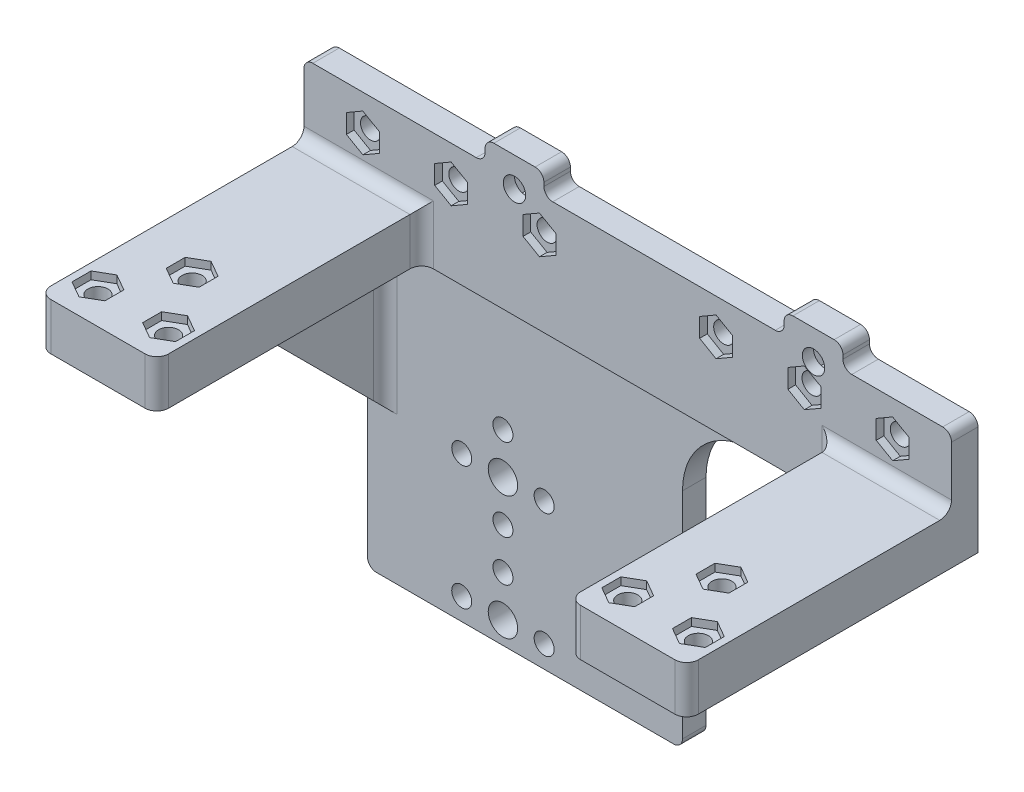
from build123d import *

# Parameters (mm, degrees)
SKETCH_1_W          = 110
SKETCH_1_H          = 20
SKETCH_1_R          = 1.7
EXTRUDE_1_DEPTH     = 4.5
SKETCH_2_W          = 20
SKETCH_2_H          = 8
EXTRUDE_2_DEPTH     = 45
SKETCH_4_W          = 10
SKETCH_4_H          = 10
EXTRUDE_3_DEPTH     = 4.5
SKETCH_5_R          = 1.9
SKETCH_5_R_2        = 1.7
CUT_EXTRUDE_1_DEPTH = 75.885745444
CUT_EXTRUDE_2_DEPTH = 1.3
CUT_EXTRUDE_3_DEPTH = 2.6
SKETCH_7_R          = 1.7
CUT_EXTRUDE_5_DEPTH = 78.673192742
CUT_EXTRUDE_6_DEPTH = 1.3
SKETCH_9_W          = 80
SKETCH_9_H          = 4
EXTRUDE_4_DEPTH     = 50
SKETCH_11_W         = 17.2
SKETCH_11_H         = 50
SKETCH_11_W_2       = 9.3
SKETCH_11_R         = 2.5
SKETCH_11_R_2       = 1.7
CUT_EXTRUDE_7_DEPTH = 90.304255218
RIB_4_REACH         = 124.026
SKETCH_12_WALL_W    = 281.40730074
SKETCH_12_WALL_H    = 3
FILLET_1_R          = 2
FILLET_2_R          = 1.5
FILLET_3_R          = 2
FILLET_4_R          = 12


with BuildPart() as part:
    # 草图1 → 凸台-拉伸1 (new body)
    with BuildSketch(Plane.XY):
        with Locations((0, 10)):
            Rectangle(SKETCH_1_W, SKETCH_1_H)
        with Locations((-45, 14)):
            Circle(SKETCH_1_R, mode=Mode.SUBTRACT)
        with Locations((-30, 14)):
            Circle(SKETCH_1_R, mode=Mode.SUBTRACT)
        with Locations((-15, 14)):
            Circle(SKETCH_1_R, mode=Mode.SUBTRACT)
        with Locations((15, 14)):
            Circle(SKETCH_1_R, mode=Mode.SUBTRACT)
        with Locations((30, 14)):
            Circle(SKETCH_1_R, mode=Mode.SUBTRACT)
        with Locations((45, 14)):
            Circle(SKETCH_1_R, mode=Mode.SUBTRACT)
    extrude(amount=EXTRUDE_1_DEPTH)

    # 草图2 → 凸台-拉伸2 (add)
    with BuildSketch(Plane.XY.offset(4.5)):
        with Locations((-45, 4)):
            Rectangle(SKETCH_2_W, SKETCH_2_H)
        with Locations((45, 4)):
            Rectangle(SKETCH_2_W, SKETCH_2_H)
    extrude(amount=EXTRUDE_2_DEPTH)

    # 草图4 → 凸台-拉伸3 (add)
    with BuildSketch(Plane.XY.offset(4.5)):
        with Locations((-19.238259457, 18.6193749)):
            Rectangle(SKETCH_4_W, SKETCH_4_H)
        with Locations((31.561740543, 18.6193749)):
            Rectangle(SKETCH_4_W, SKETCH_4_H)
    extrude(amount=-EXTRUDE_3_DEPTH)

    # 草图5 → 切除-拉伸1 (cut, through all)
    with BuildSketch(Plane.XY.offset(4.5)):
        with Locations((-19.238259457, 18.6193749)):
            Circle(SKETCH_5_R)
        with Locations((31.561740543, 18.6193749)):
            Circle(SKETCH_5_R)
        with Locations((-15, 14)):
            Circle(SKETCH_5_R_2)
        with Locations((30, 14)):
            Circle(SKETCH_5_R_2)
    extrude(amount=-CUT_EXTRUDE_1_DEPTH, mode=Mode.SUBTRACT)

    # 草图3 → 切除-拉伸2 (cut)
    with BuildSketch(Plane.XY.offset(4.5)):
        Polygon((-45, 17.22), (-47.7886018, 15.61), (-47.7886018, 12.39), (-45, 10.78), (-42.2113982, 12.39), (-42.2113982, 15.61), align=None)
        Polygon((-30, 17.22), (-32.7886018, 15.61), (-32.7886018, 12.39), (-30, 10.78), (-27.2113982, 12.39), (-27.2113982, 15.61), align=None)
        Polygon((-15, 17.22), (-17.7886018, 15.61), (-17.7886018, 12.39), (-15, 10.78), (-12.2113982, 12.39), (-12.2113982, 15.61), align=None)
        Polygon((15, 17.22), (12.2113982, 15.61), (12.2113982, 12.39), (15, 10.78), (17.7886018, 12.39), (17.7886018, 15.61), align=None)
        Polygon((30, 17.22), (27.2113982, 15.61), (27.2113982, 12.39), (30, 10.78), (32.7886018, 12.39), (32.7886018, 15.61), align=None)
        Polygon((45, 17.22), (42.2113982, 15.61), (42.2113982, 12.39), (45, 10.78), (47.7886018, 12.39), (47.7886018, 15.61), align=None)
    extrude(amount=-CUT_EXTRUDE_2_DEPTH, mode=Mode.SUBTRACT)

    # 草图6 → 切除-拉伸3 (cut)
    with BuildSketch(Plane(origin=(0, 0, 0), x_dir=(-1, 0, 0), z_dir=(0, 0, -1))):
        Polygon((-34.861740543, 18.6193749), (-33.211740543, 15.761491068), (-29.911740543, 15.761491068), (-28.261740543, 18.6193749), (-29.911740543, 21.477258733), (-33.211740543, 21.477258733), align=None)
        Polygon((15.938259457, 18.6193749), (17.588259457, 15.761491068), (20.888259457, 15.761491068), (22.538259457, 18.6193749), (20.888259457, 21.477258733), (17.588259457, 21.477258733), align=None)
    extrude(amount=-CUT_EXTRUDE_3_DEPTH, mode=Mode.SUBTRACT)

    # 草图7 → 切除-拉伸5 (cut, through all)
    with BuildSketch(Plane.XZ):
        with Locations(Location((-51, 43.5, 0), (0, 0, 270))):
            Circle(SKETCH_7_R)
        with Locations(Location((-39, 43.5, 0), (0, 0, 270))):
            Circle(SKETCH_7_R)
        with Locations(Location((-45, 33.5, 0), (0, 0, 270))):
            Circle(SKETCH_7_R)
        with Locations(Location((51, 43.5, 0), (0, 0, 270))):
            Circle(SKETCH_7_R)
        with Locations(Location((39, 43.5, 0), (0, 0, 270))):
            Circle(SKETCH_7_R)
        with Locations(Location((45, 33.5, 0), (0, 0, 270))):
            Circle(SKETCH_7_R)
    extrude(amount=-CUT_EXTRUDE_5_DEPTH, mode=Mode.SUBTRACT)

    # 草图8 → 切除-拉伸6 (cut)
    with BuildSketch(Plane(origin=(0, 8, 0), x_dir=(1, 0, 0), z_dir=(0, 1, 0))):
        Polygon((51, -46.72), (53.7886018, -45.11), (53.7886018, -41.89), (51, -40.28), (48.2113982, -41.89), (48.2113982, -45.11), align=None)
        Polygon((39, -46.72), (41.7886018, -45.11), (41.7886018, -41.89), (39, -40.28), (36.2113982, -41.89), (36.2113982, -45.11), align=None)
        Polygon((45, -36.72), (47.7886018, -35.11), (47.7886018, -31.89), (45, -30.28), (42.2113982, -31.89), (42.2113982, -35.11), align=None)
        Polygon((-39, -46.72), (-36.2113982, -45.11), (-36.2113982, -41.89), (-39, -40.28), (-41.7886018, -41.89), (-41.7886018, -45.11), align=None)
        Polygon((-51, -46.72), (-48.2113982, -45.11), (-48.2113982, -41.89), (-51, -40.28), (-53.7886018, -41.89), (-53.7886018, -45.11), align=None)
        Polygon((-45, -36.72), (-42.2113982, -35.11), (-42.2113982, -31.89), (-45, -30.28), (-47.7886018, -31.89), (-47.7886018, -35.11), align=None)
    extrude(amount=-CUT_EXTRUDE_6_DEPTH, mode=Mode.SUBTRACT)

    # 草图9 → 凸台-拉伸4 (add)
    with BuildSketch(Plane.XZ):
        with Locations((-14, 2)):
            Rectangle(SKETCH_9_W, SKETCH_9_H)
    extrude(amount=EXTRUDE_4_DEPTH)

    # 草图11 → 切除-拉伸7 (cut, through all)
    with BuildSketch(Plane(origin=(0, 0, 0), x_dir=(-1, 0, 0), z_dir=(0, 0, -1))):
        with Locations((-17.4, -25)):
            Rectangle(SKETCH_11_W, SKETCH_11_H)
        with Locations((49.35, -25)):
            Rectangle(SKETCH_11_W_2, SKETCH_11_H)
        with Locations((21.7, -46.25)):
            Circle(SKETCH_11_R)
        with Locations((14.7, -46.25)):
            Circle(SKETCH_11_R_2)
        with Locations((28.7, -46.25)):
            Circle(SKETCH_11_R_2)
        with Locations((21.7, -39.25)):
            Circle(SKETCH_11_R_2)
        with Locations((21.7, -32.25)):
            Circle(SKETCH_11_R_2)
        with Locations((14.7, -25.25)):
            Circle(SKETCH_11_R_2)
        with Locations((21.7, -18.25)):
            Circle(SKETCH_11_R_2)
        with Locations((28.7, -25.25)):
            Circle(SKETCH_11_R_2)
        with Locations((21.7, -25.25)):
            Circle(SKETCH_11_R)
        with Locations((4.2, -35.75)):
            Circle(SKETCH_11_R_2)
    extrude(amount=-CUT_EXTRUDE_7_DEPTH, mode=Mode.SUBTRACT)

    # 草图12 wall → 筋4 (add, up to next)
    with BuildSketch(Plane(origin=(-44.7, -12.5, 16.5), x_dir=(0, 0.707106781187, 0.707106781187), z_dir=(0, 0.707106781187, -0.707106781187)), mode=Mode.PRIVATE) as rib_4_sk1:
        with Locations((0, 1.5)):
            Rectangle(SKETCH_12_WALL_W, SKETCH_12_WALL_H)
    rib_4_tool1 = extrude(rib_4_sk1.sketch, amount=RIB_4_REACH, mode=Mode.PRIVATE) - part.part
    add(rib_4_tool1.solids().sort_by_distance((-44.7, -12.5, 16.5))[0])

    # 圆角1
    fillet_1_edges = [part.edges().sort_by_distance(p)[0] for p in [
        (-35, 4, 4.5),
        (-45, 8, 4.5),
        (45, 8, 4.5),
        (35, 4, 4.5),
        (-44.7, 0, 14.5),
        (-41.7, -12.5, 4),
        (-41.7, 0, 16.5),
    ]]
    fillet(fillet_1_edges, radius=FILLET_1_R)

    # 圆角2
    fillet_2_edges = [part.edges().sort_by_distance(p)[0] for p in [
        (-44.7, -50, 2),
        (8.8, -50, 2),
        (-24.238259457, 20, 2.25),
        (-14.238259457, 23.6193749, 2.25),
        (-14.238259457, 20, 2.25),
        (-24.238259457, 23.6193749, 2.25),
        (-55, 20, 2.25),
        (55, 20, 2.25),
        (36.561740543, 23.6193749, 2.25),
        (36.561740543, 20, 2.25),
        (26.561740543, 20, 2.25),
        (26.561740543, 23.6193749, 2.25),
    ]]
    fillet(fillet_2_edges, radius=FILLET_2_R)

    # 圆角3
    fillet_3_edges = [part.edges().sort_by_distance(p)[0] for p in [
        (-55, 4, 49.5),
        (-35, 4, 49.5),
        (55, 4, 49.5),
        (35, 4, 49.5),
    ]]
    fillet(fillet_3_edges, radius=FILLET_3_R)

    # 圆角4
    fillet_4_edges = [part.edges().sort_by_distance(p)[0] for p in [
        (8.8, 0, 2),
    ]]
    fillet(fillet_4_edges, radius=FILLET_4_R)


solid = part.part
